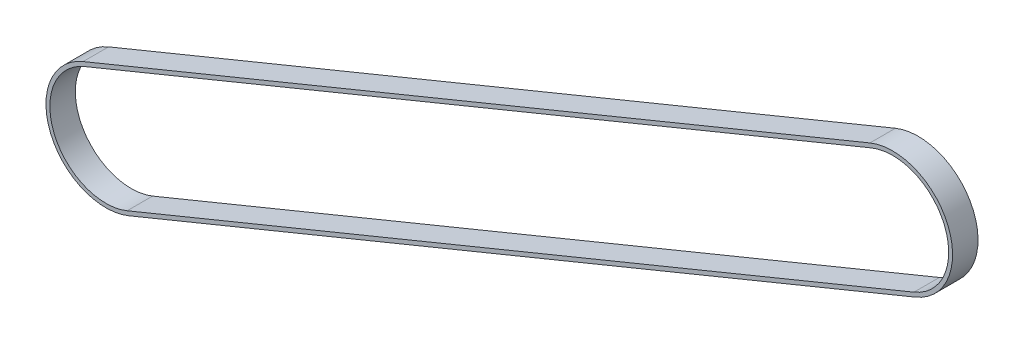
from build123d import *

# Parameters (mm, degrees)
SKETCH4_W = 15
SKETCH4_H = 2.286


with BuildPart() as part:
    # Sweep1: sweep along a path in Sketch2
    with BuildLine(Plane.XY) as sweep1_path:
        Line((12.530028775, -30.528579509), (-451.04806694, -220.788128294))
        ThreePointArc((-451.04806694, -220.788128294), (-494.106439454, -202.788779514), (-476.107090674, -159.730407001))
        Line((-476.107090674, -159.730407001), (-12.528994959, 30.529141785))
        ThreePointArc((-12.528994959, 30.529141785), (30.529377554, 12.529793005), (12.530028775, -30.528579509))
    # Sketch4 → Sweep1 (sweep)
    with BuildSketch(Plane(origin=(-12.528994959, 30.529141785, 0), x_dir=(0, 0, -1), z_dir=(0.925116989288595, 0.37968217778769353, 0))):
        with Locations((-7.5, 1.143)):
            Rectangle(SKETCH4_W, SKETCH4_H)
    sweep(path=sweep1_path.line)


solid = part.part
